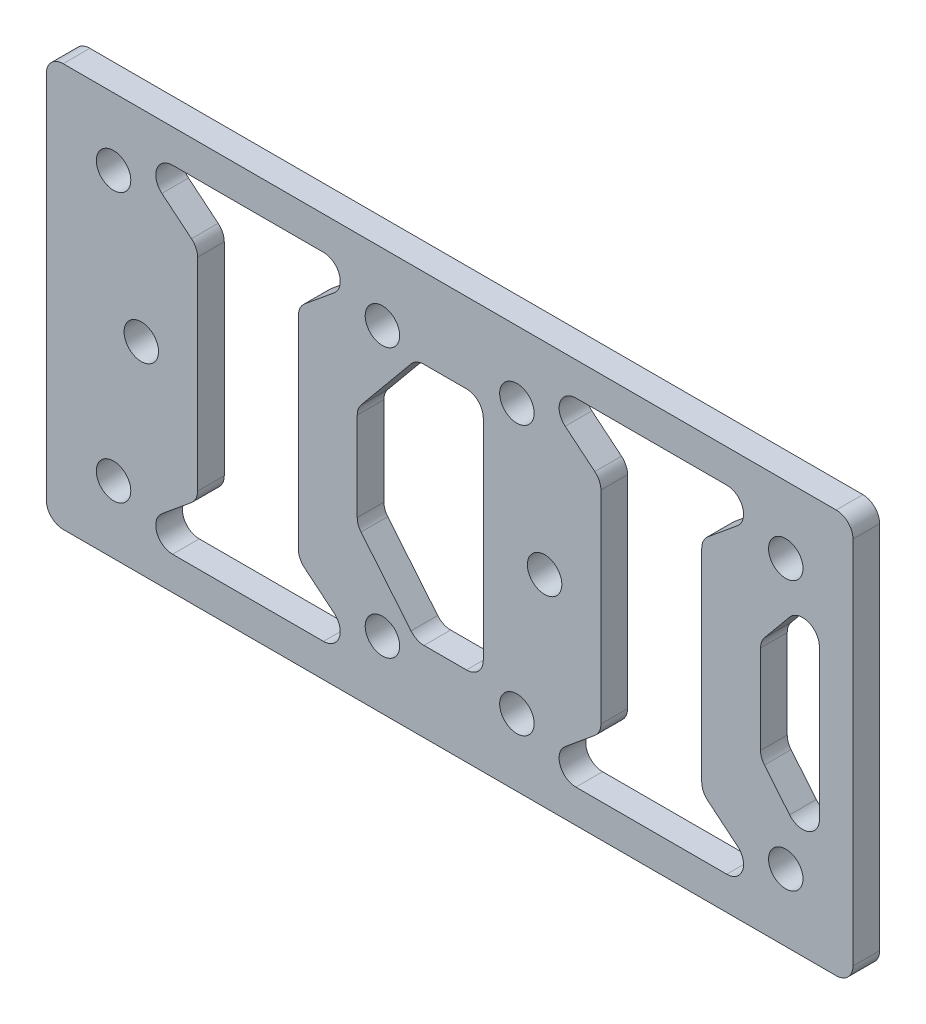
from build123d import *

# Parameters (mm, degrees)
SKETCH1_W           = 96
SKETCH1_H           = 48
SKETCH1_R           = 2.05
BOSS_EXTRUDE1_DEPTH = 3.175
FILLET1_R           = 2


with BuildPart() as part:
    # Sketch1 → Boss-Extrude1 (new body)
    with BuildSketch(Plane.XY):
        Rectangle(SKETCH1_W, SKETCH1_H)
        with Locations((-40, 16)):
            Circle(SKETCH1_R, mode=Mode.SUBTRACT)
        with Locations((-8, 16)):
            Circle(SKETCH1_R, mode=Mode.SUBTRACT)
        with Locations((-8, -16)):
            Circle(SKETCH1_R, mode=Mode.SUBTRACT)
        with Locations((-40, -16)):
            Circle(SKETCH1_R, mode=Mode.SUBTRACT)
        with Locations((8, 16)):
            Circle(SKETCH1_R, mode=Mode.SUBTRACT)
        with Locations((8, -16)):
            Circle(SKETCH1_R, mode=Mode.SUBTRACT)
        with Locations((40, -16)):
            Circle(SKETCH1_R, mode=Mode.SUBTRACT)
        with Locations((40, 16)):
            Circle(SKETCH1_R, mode=Mode.SUBTRACT)
        with Locations((-36.7, 0)):
            Circle(SKETCH1_R, mode=Mode.SUBTRACT)
        with Locations((11.3, 0)):
            Circle(SKETCH1_R, mode=Mode.SUBTRACT)
        Polygon((-38.544929421, 20.05), (-30, 13), (-30, -13), (-38.544929421, -20.05), (-9.455070579, -20.05), (-18, -13), (-18, 13), (-9.455070579, 20.05), align=None, mode=Mode.SUBTRACT)
        Polygon((-11, -6), (-11, 6), (-4, 14.484327085), (4, 14.484327085), (4, -14.484327085), (-4, -14.484327085), align=None, mode=Mode.SUBTRACT)
        Polygon((38.544929421, -20.05), (30, -13), (30, 13), (38.544929421, 20.05), (9.455070579, 20.05), (18, 13), (18, -13), (9.455070579, -20.05), align=None, mode=Mode.SUBTRACT)
        Polygon((37, -6), (37, 6), (44, 14.484327085), (44, -14.484327085), align=None, mode=Mode.SUBTRACT)
    extrude(amount=BOSS_EXTRUDE1_DEPTH)

    # Fillet1
    fillet1_edges = [part.edges().sort_by_distance(p)[0] for p in [
        (-9.455070579, 20.05, 1.5875),
        (-38.544929421, 20.05, 1.5875),
        (-30, 13, 1.5875),
        (-30, -13, 1.5875),
        (-38.544929421, -20.05, 1.5875),
        (-9.455070579, -20.05, 1.5875),
        (-18, -13, 1.5875),
        (-18, 13, 1.5875),
        (38.544929421, 20.05, 1.5875),
        (9.455070579, 20.05, 1.5875),
        (18, 13, 1.5875),
        (18, -13, 1.5875),
        (9.455070579, -20.05, 1.5875),
        (38.544929421, -20.05, 1.5875),
        (30, -13, 1.5875),
        (30, 13, 1.5875),
        (-4, 14.484327085, 1.5875),
        (-11, 6, 1.5875),
        (-11, -6, 1.5875),
        (-4, -14.484327085, 1.5875),
        (4, -14.484327085, 1.5875),
        (4, 14.484327085, 1.5875),
        (37, -6, 1.5875),
        (44, -14.484327085, 1.5875),
        (44, 14.484327085, 1.5875),
        (37, 6, 1.5875),
        (-48, 24, 1.5875),
        (48, 24, 1.5875),
        (48, -24, 1.5875),
        (-48, -24, 1.5875),
    ]]
    fillet(fillet1_edges, radius=FILLET1_R)


solid = part.part
